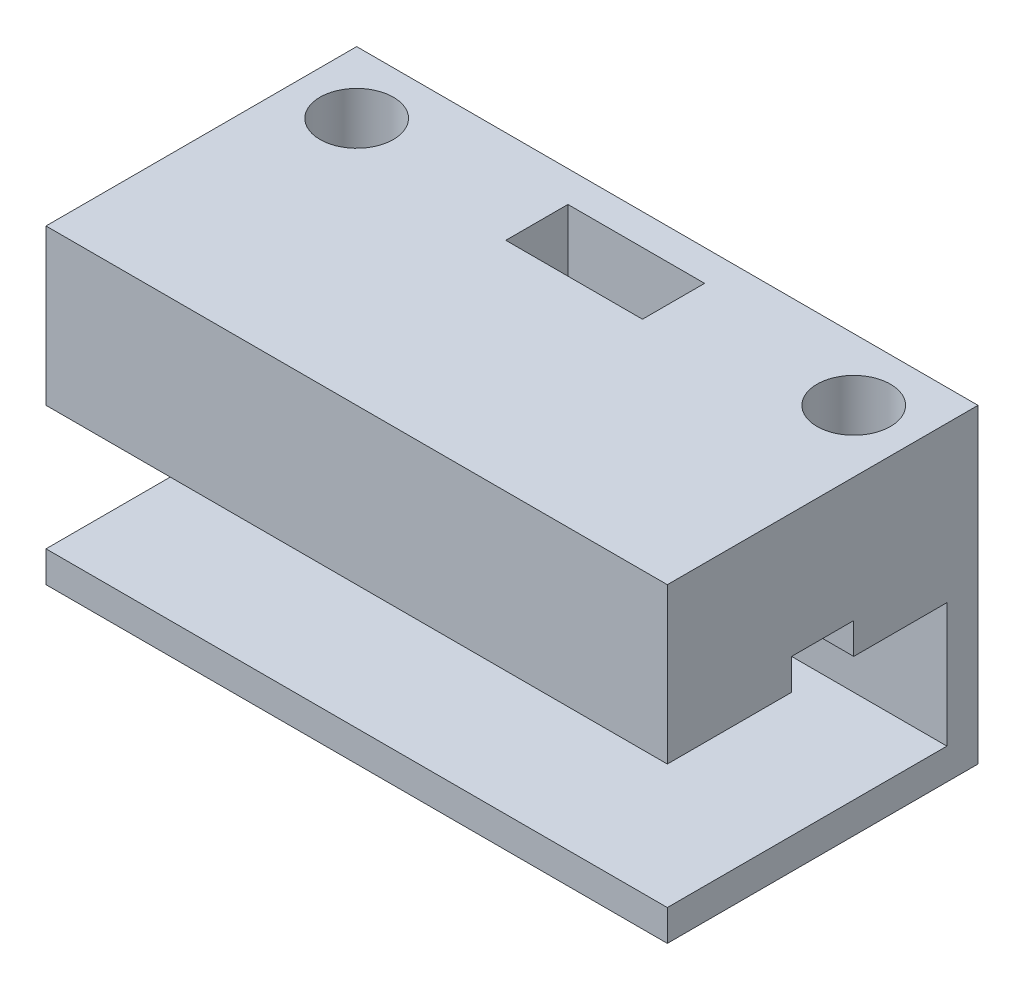
from build123d import *

# Parameters (mm, degrees)
SKETCH1_W           = 25.4
SKETCH1_H           = 12.7
BOSS_EXTRUDE1_DEPTH = 12.7
SKETCH2_R           = 1.5
CUT_EXTRUDE1_DEPTH  = 5.08
SKETCH4_W           = 11.43
SKETCH4_H           = 5.08
CUT_EXTRUDE3_DEPTH  = 27.432
SKETCH6_W           = 5.588
SKETCH6_H           = 2.54
CUT_EXTRUDE5_DEPTH  = 9.652
SKETCH7_W           = 2.54
SKETCH7_H           = 1.27
CUT_EXTRUDE6_DEPTH  = 26.924


with BuildPart() as part:
    # Sketch1 → Boss-Extrude1 (new body)
    with BuildSketch(Plane.XY):
        Rectangle(SKETCH1_W, SKETCH1_H)
    extrude(amount=BOSS_EXTRUDE1_DEPTH)

    # Sketch2 → Cut-Extrude1 (cut)
    with BuildSketch(Plane(origin=(0, 6.35, 0), x_dir=(1, 0, 0), z_dir=(0, 1, 0))):
        with Locations(Location((-10.16, -2.54, 0), (0, 0, 270))):
            Circle(SKETCH2_R)
        with Locations(Location((10.16, -2.54, 0), (0, 0, 270))):
            Circle(SKETCH2_R)
    extrude(amount=-CUT_EXTRUDE1_DEPTH, mode=Mode.SUBTRACT)

    # Sketch4 → Cut-Extrude3 (cut)
    with BuildSketch(Plane(origin=(12.7, 0, 0), x_dir=(0, 0, -1), z_dir=(1, 0, 0))):
        with Locations((-6.985, -2.54)):
            Rectangle(SKETCH4_W, SKETCH4_H)
    extrude(amount=-CUT_EXTRUDE3_DEPTH, mode=Mode.SUBTRACT)

    # Sketch6 → Cut-Extrude5 (cut)
    with BuildSketch(Plane(origin=(0, 6.35, 0), x_dir=(1, 0, 0), z_dir=(0, 1, 0))):
        with Locations((0, -2.54)):
            Rectangle(SKETCH6_W, SKETCH6_H)
    extrude(amount=-CUT_EXTRUDE5_DEPTH, mode=Mode.SUBTRACT)

    # Sketch7 → Cut-Extrude6 (cut)
    with BuildSketch(Plane(origin=(12.7, 0, 0), x_dir=(0, 0, -1), z_dir=(1, 0, 0))):
        with Locations((-6.35, 0.635)):
            Rectangle(SKETCH7_W, SKETCH7_H)
    extrude(amount=-CUT_EXTRUDE6_DEPTH, mode=Mode.SUBTRACT)


solid = part.part
